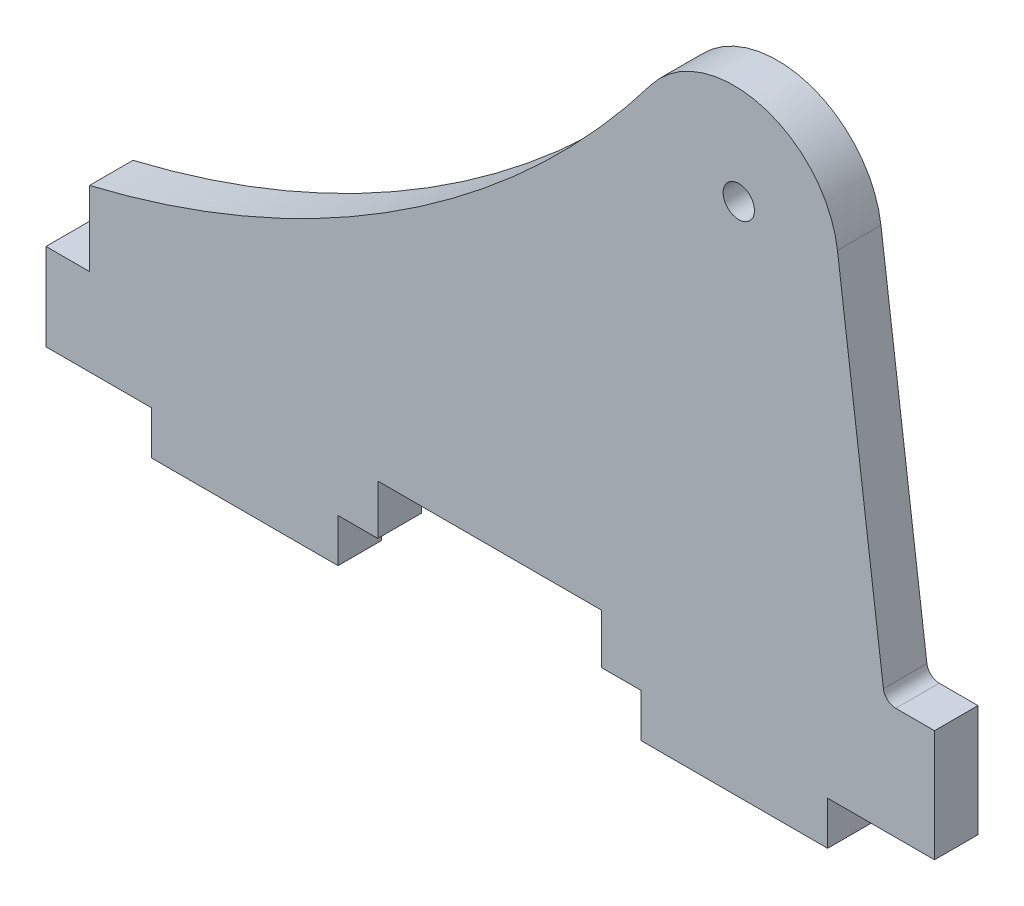
from build123d import *

# Parameters (mm, degrees)
SKETCH1_R           = 1.26
BOSS_EXTRUDE1_DEPTH = 3.5
FILLET1_R           = 1


with BuildPart() as part:
    # Sketch1 → Boss-Extrude1 (new body)
    # profile 1 of 2: a face of its own
    with BuildSketch(Plane.XY):
        with BuildLine():
            Line((3.5, 10.5), (0, 10.5))
            Line((0, 10.5), (0, 3.5))
            Line((0, 3.5), (8.5, 3.5))
            Line((8.5, 3.5), (8.5, 0))
            Line((8.5, 0), (23.5, 0))
            Line((23.5, 0), (23.5, 3.5))
            Line((23.5, 3.5), (26.7, 3.5))
            Line((26.7, 3.5), (26.7, 7.5))
            Line((26.7, 7.5), (35.7, 7.5))
            Line((35.7, 7.5), (35.7, 32.54836019))
            ThreePointArc((35.7, 32.54836019), (20.513860835, 22.69057725), (3.5, 16.5))
            Line((3.5, 16.5), (3.5, 10.5))
        make_face()
    # profile 2 of 2: a face of its own
    with BuildSketch(Plane.XY):
        with BuildLine():
            ThreePointArc((48.657927336, 46.063814965), (42.575731037, 38.925687301), (35.7, 32.54836019))
            Line((35.7, 32.54836019), (35.7, 7.5))
            Line((35.7, 7.5), (44.7, 7.5))
            Line((44.7, 7.5), (44.7, 3.5))
            Line((44.7, 3.5), (47.9, 3.5))
            Line((47.9, 3.5), (47.9, 0))
            Line((47.9, 0), (62.9, 0))
            Line((62.9, 0), (62.9, 3.5))
            Line((62.9, 3.5), (71.5, 3.5))
            Line((71.5, 3.5), (71.5, 12.5))
            Line((71.5, 12.5), (67.5, 12.5))
            Line((67.5, 12.5), (63.691186196, 42.073003524))
            ThreePointArc((63.691186196, 42.073003524), (57.515260243, 49.118796295), (48.657927336, 46.063814965))
        make_face()
        with Locations((55.75, 41.5)):
            Circle(SKETCH1_R, mode=Mode.SUBTRACT)
    extrude(amount=BOSS_EXTRUDE1_DEPTH)

    # Fillet1
    fillet1_edges = [part.edges().sort_by_distance(p)[0] for p in [
        (67.5, 12.5, 1.75),
    ]]
    fillet(fillet1_edges, radius=FILLET1_R)


solid = part.part
